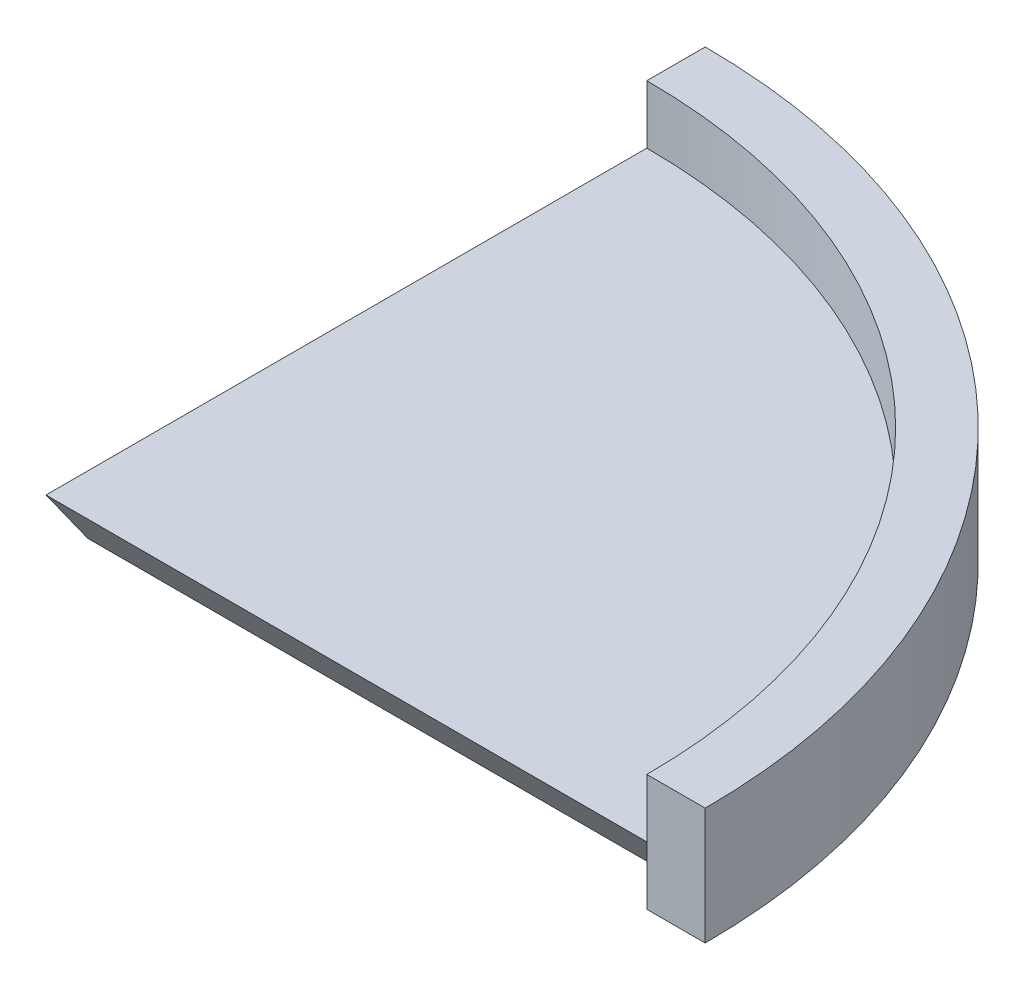
from build123d import *

# Parameters (mm, degrees)
CROQUIS3_W            = 395
CROQUIS3_H            = 35
REVOLUCI_N1_ANGLE     = 90
CROQUIS5_W            = 35
CROQUIS5_H            = 35
REVOLUCI_N3_ANGLE     = 90
CORTAR_EXTRUIR5_DEPTH = 360


with BuildPart() as part:
    # Croquis3 → Revolución1 (revolve)
    with BuildSketch(Plane(origin=(0, 0, 0), x_dir=(0, 0, -1), z_dir=(1, 0, 0))):
        with Locations((-727.916095406, 391.262754858)):
            Rectangle(CROQUIS3_W, CROQUIS3_H)
    revolve(axis=Axis((0, 408.762754858, 925.416095406), (0, -1, 0)), revolution_arc=REVOLUCI_N1_ANGLE)

    # Croquis5 → Revolución3 (revolve)
    with BuildSketch(Plane(origin=(0, 0, 0), x_dir=(0, 0, -1), z_dir=(1, 0, 0))):
        with Locations((-547.916095406, 426.262754858)):
            Rectangle(CROQUIS5_W, CROQUIS5_H)
    revolve(axis=Axis((0, 408.762754858, 925.416095406), (0, -1, 0)), revolution_arc=REVOLUCI_N3_ANGLE)

    # Croquis17 → Cortar-Extruir5 (cut)
    with BuildSketch(Plane.ZY):
        Polygon((925.416095406, 373.762754858), (900.416095406, 373.762754858), (925.416095406, 408.762754858), align=None)
    extrude(amount=-CORTAR_EXTRUIR5_DEPTH, mode=Mode.SUBTRACT)


solid = part.part
